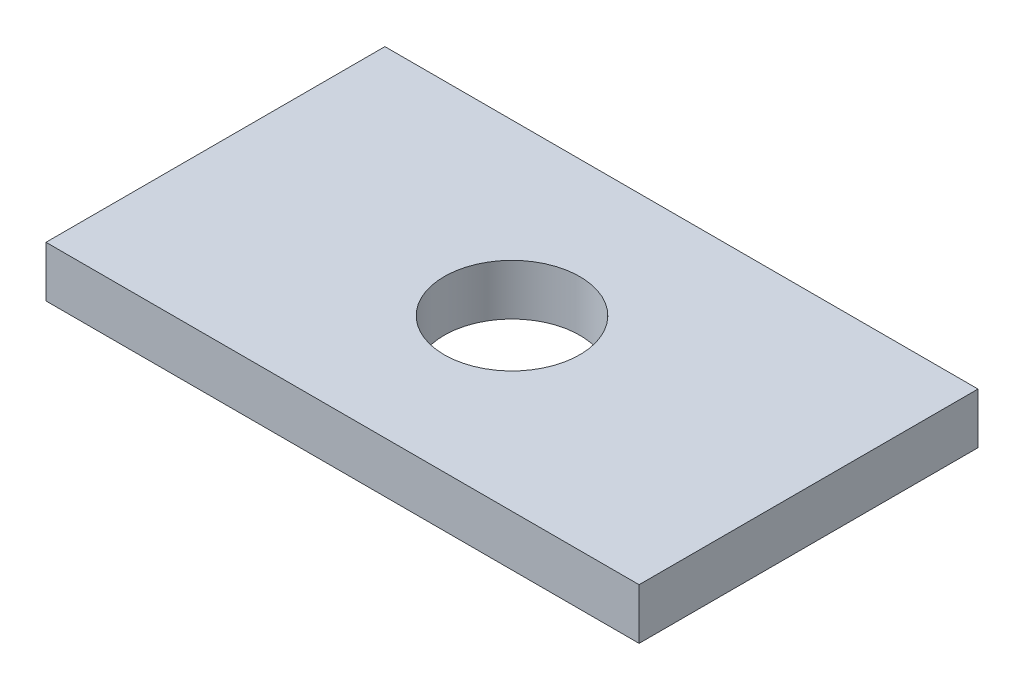
from build123d import *

# Parameters (mm, degrees)
SKETCH1_W           = 70
SKETCH1_H           = 6
BOSS_EXTRUDE1_DEPTH = 40
SKETCH2_R           = 8
CUT_EXTRUDE1_DEPTH  = 54.488316481


with BuildPart() as part:
    # Sketch1 → Boss-Extrude1 (new body)
    with BuildSketch(Plane.XY):
        Rectangle(SKETCH1_W, SKETCH1_H)
    extrude(amount=BOSS_EXTRUDE1_DEPTH)

    # Sketch2 → Cut-Extrude1 (cut, through all)
    with BuildSketch(Plane(origin=(0, 3, 0), x_dir=(1, 0, 0), z_dir=(0, 1, 0))):
        with Locations(Location((0, -20, 0), (0, 0, 270))):
            Circle(SKETCH2_R)
    extrude(amount=-CUT_EXTRUDE1_DEPTH, mode=Mode.SUBTRACT)


solid = part.part
